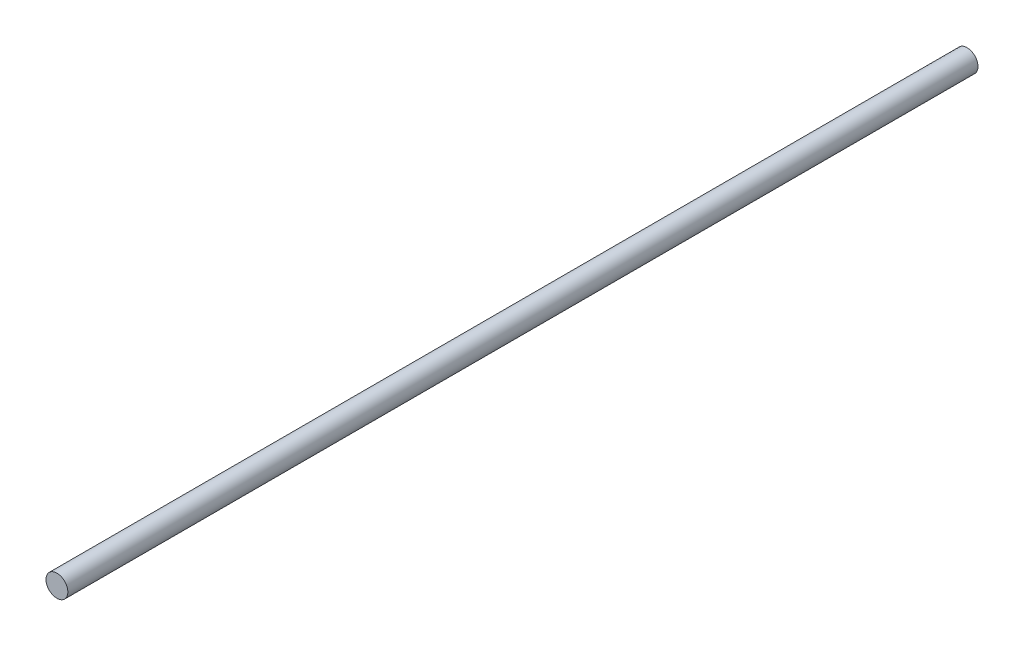
from build123d import *

# Parameters (mm, degrees)
SKETCH_1_R      = 3
EXTRUDE_1_DEPTH = 250


with BuildPart() as part:
    # 草图1 → 凸台-拉伸1 (new body)
    with BuildSketch(Plane.XY):
        Circle(SKETCH_1_R)
    extrude(amount=EXTRUDE_1_DEPTH)


solid = part.part
